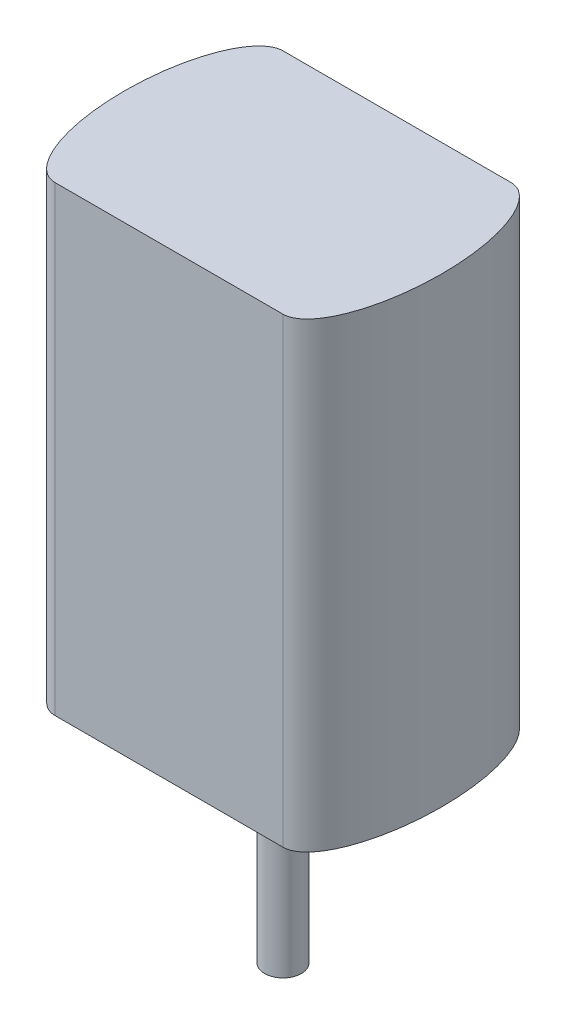
from build123d import *

# Parameters (mm, degrees)
SKETCH2_RX          = 6.2
SKETCH2_RY          = 2.428962841
SKETCH2_RY_2        = 2.417240448
SKETCH2_W           = 12.4
SKETCH2_H           = 12.4
BOSS_EXTRUDE1_DEPTH = 25.1
SKETCH3_R           = 3.075
BOSS_EXTRUDE2_DEPTH = 1.6
SKETCH4_R           = 1
BOSS_EXTRUDE3_DEPTH = 10.05


with BuildPart() as part:
    # Sketch2 → Boss-Extrude1 (new body)
    with BuildSketch(Plane(origin=(0, 0, 0), x_dir=(1, 0, 0), z_dir=(0, 1, 0))):
        with Locations(Location((-6.2, 0), (0, 0, -90))):
            Ellipse(SKETCH2_RX, SKETCH2_RY)
        with Locations(Location((6.2, 0), (0, 0, -90))):
            Ellipse(SKETCH2_RX, SKETCH2_RY_2)
        Rectangle(SKETCH2_W, SKETCH2_H)
    extrude(amount=BOSS_EXTRUDE1_DEPTH)

    # Sketch3 → Boss-Extrude2 (add)
    with BuildSketch(Plane.XZ):
        with Locations(Location((0, 0, 0), (0, 0, 270))):
            Circle(SKETCH3_R)
    extrude(amount=BOSS_EXTRUDE2_DEPTH)

    # Sketch4 → Boss-Extrude3 (add)
    with BuildSketch(Plane.XZ.offset(1.6)):
        with Locations(Location((0, 0, 0), (0, 0, 270))):
            Circle(SKETCH4_R)
    extrude(amount=BOSS_EXTRUDE3_DEPTH)


solid = part.part
